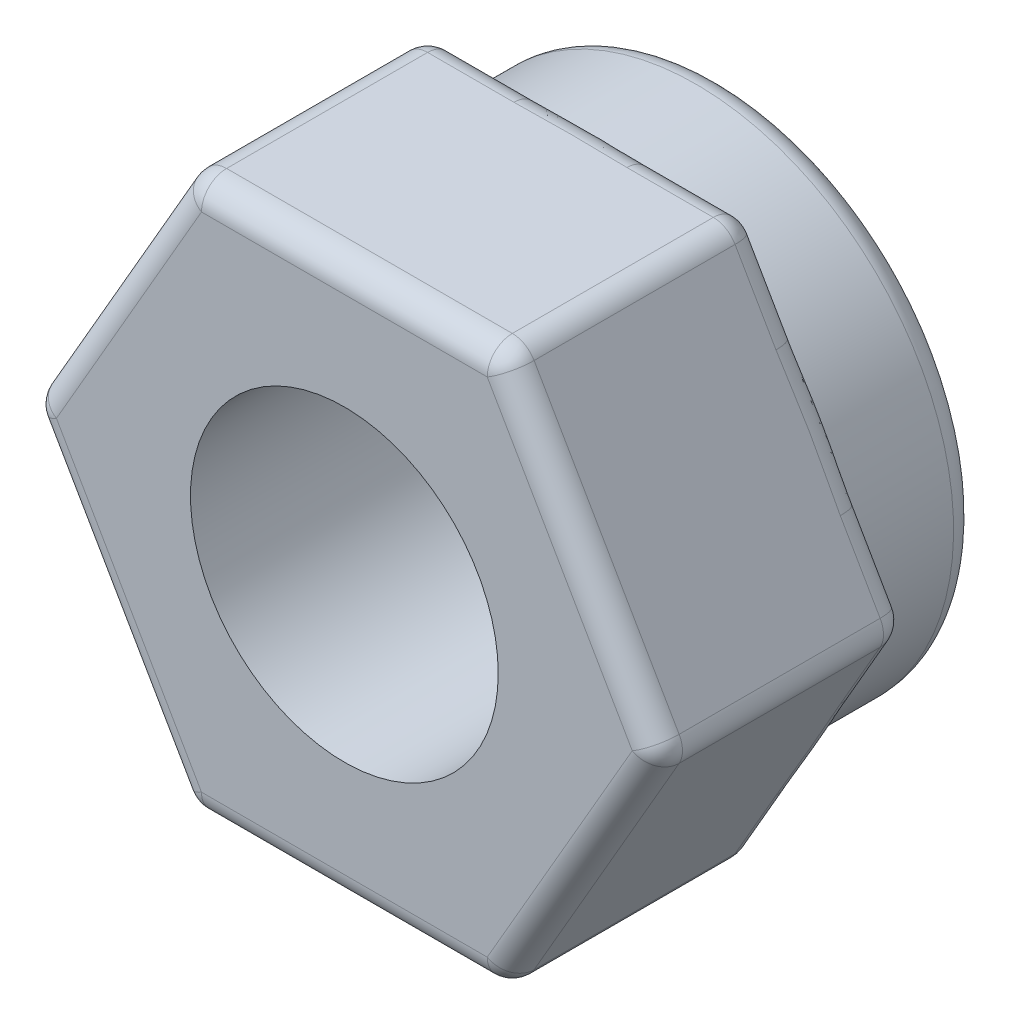
from build123d import *

# Parameters (mm, degrees)
SKETCH1_R      = 3.1115
EXTRUDE1_DEPTH = 5.08
SKETCH2_R      = 5.207
SKETCH2_R_2    = 3.1115
EXTRUDE2_DEPTH = 2.54
FILLET1_R      = 0.508


with BuildPart() as part:
    # Sketch1 → Extrude1 (new body)
    with BuildSketch(Plane.XY):
        Polygon((3.182239214, 5.588), (-3.182239214, 5.588), (-6.408472518, 0), (-3.182239214, -5.588), (3.182239214, -5.588), (6.408472518, 0), align=None)
        Circle(SKETCH1_R, mode=Mode.SUBTRACT)
    extrude(amount=-EXTRUDE1_DEPTH)

    # Sketch2 → Extrude2 (add)
    with BuildSketch(Plane(origin=(0, 0, -5.08), x_dir=(-1, 0, 0), z_dir=(0, 0, -1))):
        with Locations(Location((0, 0, 0), (0, 0, 180))):
            Circle(SKETCH2_R)
        with Locations(Location((0, 0, 0), (0, 0, 180))):
            Circle(SKETCH2_R_2, mode=Mode.SUBTRACT)
    extrude(amount=EXTRUDE2_DEPTH)

    # Fillet1
    fillet1_edges = [part.edges().sort_by_distance(p)[0] for p in [
        (-4.795355866, 2.794, -5.08),
        (6.408472518, 0, -2.54),
        (3.182239214, -5.588, -2.54),
        (-3.182239214, -5.588, -2.54),
        (-6.408472518, 0, -2.54),
        (-3.182239214, 5.588, -2.54),
        (3.182239214, 5.588, -2.54),
        (-4.795355866, -2.794, -5.08),
        (0, -5.588, -5.08),
        (4.795355866, -2.794, -5.08),
        (-5.207, 0, -7.62),
        (4.795355866, 2.794, -5.08),
        (4.795355866, -2.794, 0),
        (0, -5.588, 0),
        (-4.795355866, -2.794, 0),
        (0, 5.588, -5.08),
        (-4.795355866, 2.794, 0),
        (0, 5.588, 0),
        (4.795355866, 2.794, 0),
    ]]
    fillet(fillet1_edges, radius=FILLET1_R)


solid = part.part
